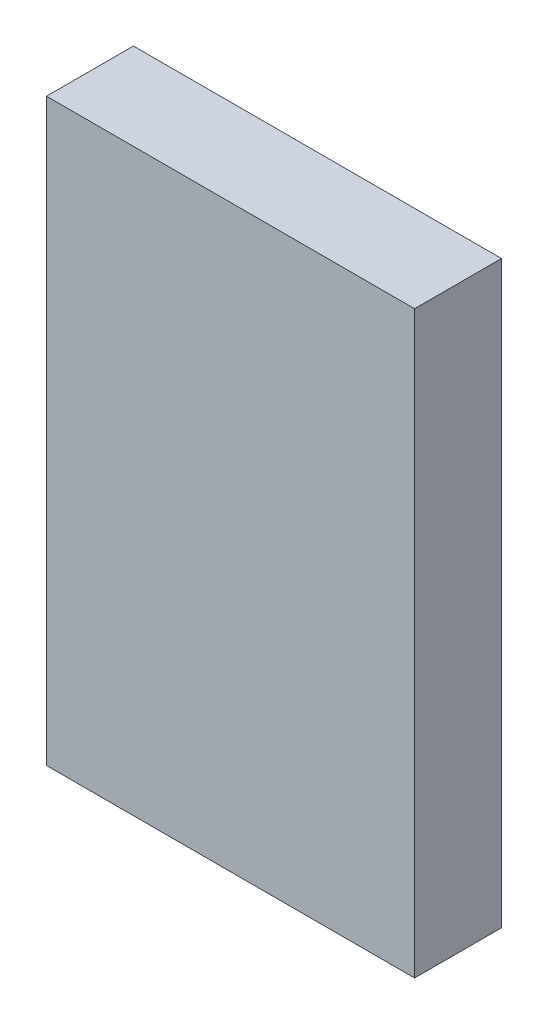
from build123d import *

# Parameters (mm, degrees)
SKETCH_1_W      = 12.7
SKETCH_1_H      = 20
EXTRUDE_1_DEPTH = 3


with BuildPart() as part:
    # 草圖1 → 填料-伸長1 (new body)
    with BuildSketch(Plane.XY):
        Rectangle(SKETCH_1_W, SKETCH_1_H)
    extrude(amount=EXTRUDE_1_DEPTH)


solid = part.part
